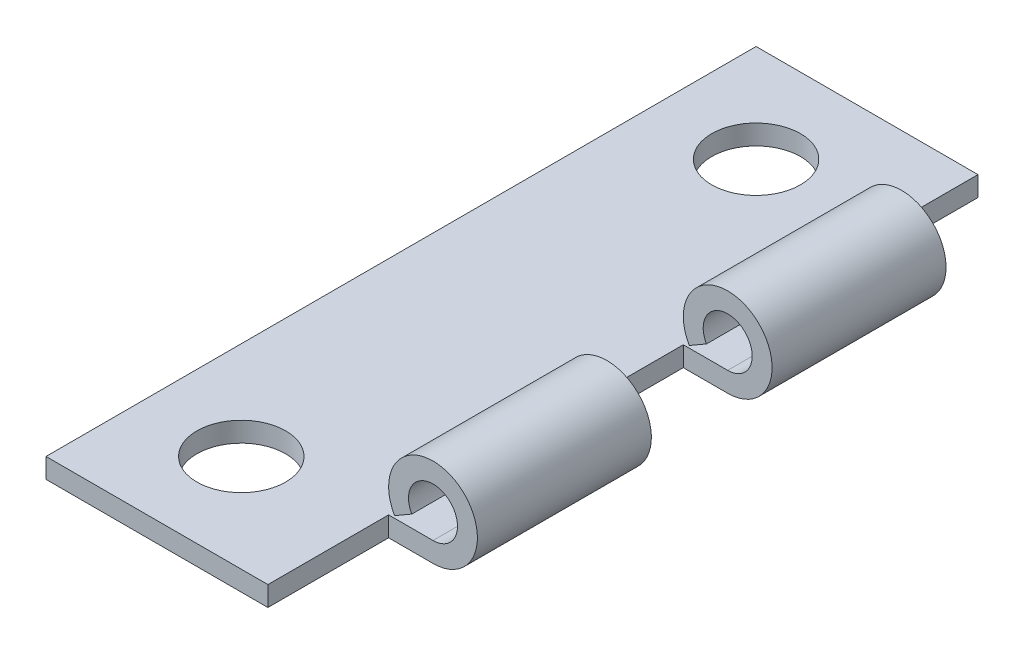
from build123d import *

# Parameters (mm, degrees)
BOSS_EXTRUDE1_DEPTH = 50.8
SKETCH2_R           = 3.175
SKETCH2_W           = 6.35
SKETCH2_H           = 8.636
CUT_EXTRUDE1_DEPTH  = 56.811406764


with BuildPart() as part:
    # Sketch1 → Boss-Extrude1 (new body)
    with BuildSketch(Plane.XY):
        with BuildLine():
            Line((0, 0), (19.05, 0))
            ThreePointArc((19.05, 0), (20.6375, 5.924630657), (16.300369343, 1.5875))
            Line((16.300369343, 1.5875), (17.532203877, 2.2987))
            ThreePointArc((17.532203877, 2.2987), (19.9263, 4.692796123), (19.05, 1.4224))
            Line((19.05, 1.4224), (0, 1.4224))
            Line((0, 1.4224), (0, 0))
        make_face()
    extrude(amount=BOSS_EXTRUDE1_DEPTH)

    # Sketch2 → Cut-Extrude1 (cut, through all)
    with BuildSketch(Plane.XZ):
        with Locations(Location((6.985, 43.815, 0), (0, 0, 270))):
            Circle(SKETCH2_R)
        with Locations(Location((6.985, 6.985, 0), (0, 0, 270))):
            Circle(SKETCH2_R)
        with Locations((19.05, 46.482)):
            Rectangle(SKETCH2_W, SKETCH2_H)
        with Locations((19.05, 25.4)):
            Rectangle(SKETCH2_W, SKETCH2_H)
        with Locations((19.05, 4.318)):
            Rectangle(SKETCH2_W, SKETCH2_H)
    extrude(amount=-CUT_EXTRUDE1_DEPTH, mode=Mode.SUBTRACT)


solid = part.part
